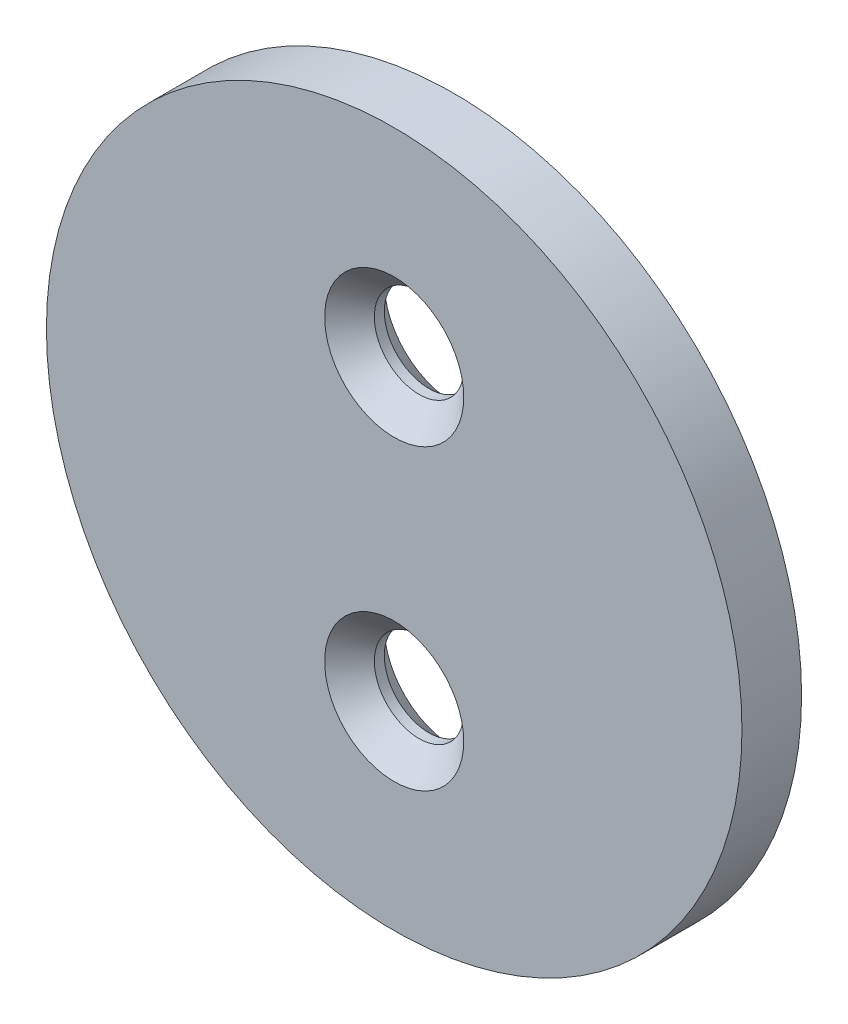
from build123d import *

# Parameters (mm, degrees)
SKETCH_1_R          = 7
EXTRUDE_1_DEPTH     = 1.2
SKETCH_2_R          = 0.9
CUT_EXTRUDE_1_DEPTH = 10.97196069
CHAMFER_1_SIZE      = 0.5


with BuildPart() as part:
    # 草图1 → 凸台-拉伸1 (new body)
    with BuildSketch(Plane.XY):
        Circle(SKETCH_1_R)
    extrude(amount=EXTRUDE_1_DEPTH)

    # 草图2 → 切除-拉伸1 (cut, through all)
    with BuildSketch(Plane.XY.offset(1.2)):
        with Locations((0, 3)):
            Circle(SKETCH_2_R)
        with Locations(Location((0, -3, 0), (0, 0, 180))):
            Circle(SKETCH_2_R)
    extrude(amount=-CUT_EXTRUDE_1_DEPTH, mode=Mode.SUBTRACT)

    # Chamfer 1
    chamfer_1_edges = [part.edges().sort_by_distance(p)[0] for p in [
        (0.9, -3, 1.2),
        (-0.9, 3, 0),
        (-0.9, 3, 1.2),
        (0.9, -3, 0),
    ]]
    chamfer(chamfer_1_edges, length=CHAMFER_1_SIZE)


solid = part.part
